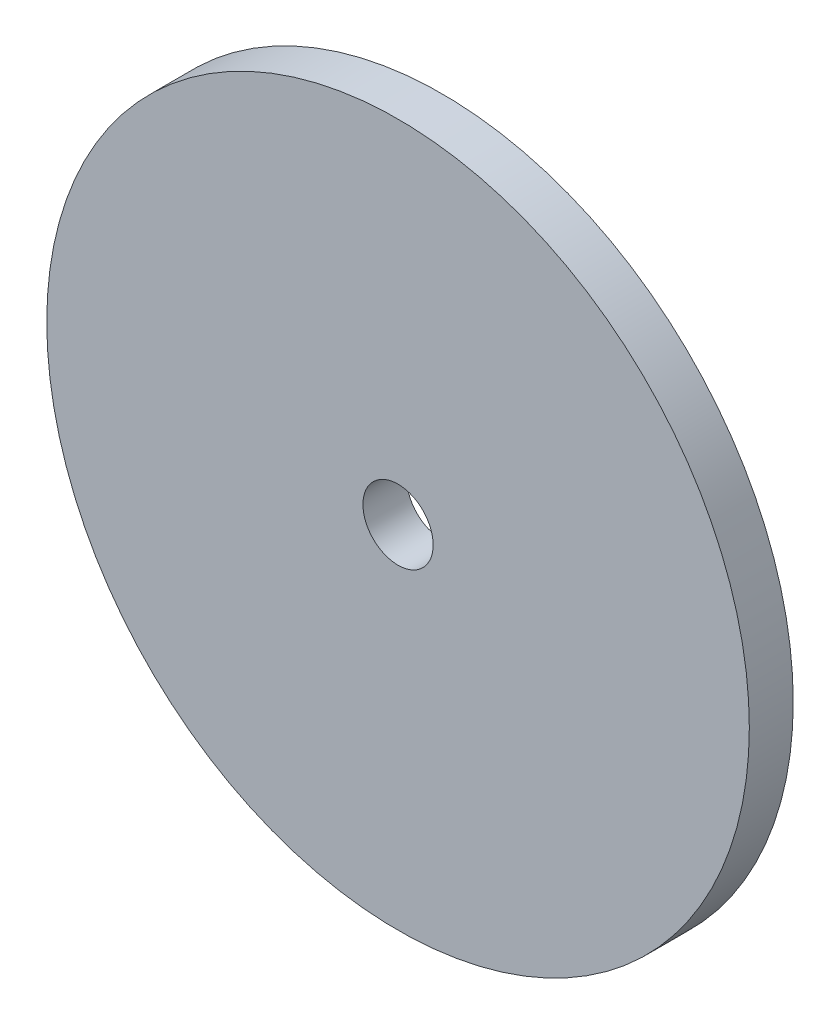
from build123d import *

# Parameters (mm, degrees)
SKETCH_1_R      = 40
SKETCH_1_R_2    = 4
EXTRUDE_1_DEPTH = 5


with BuildPart() as part:
    # 草图1 → 凸台-拉伸1 (new body)
    with BuildSketch(Plane.XY):
        Circle(SKETCH_1_R)
        Circle(SKETCH_1_R_2, mode=Mode.SUBTRACT)
    extrude(amount=EXTRUDE_1_DEPTH)


solid = part.part
